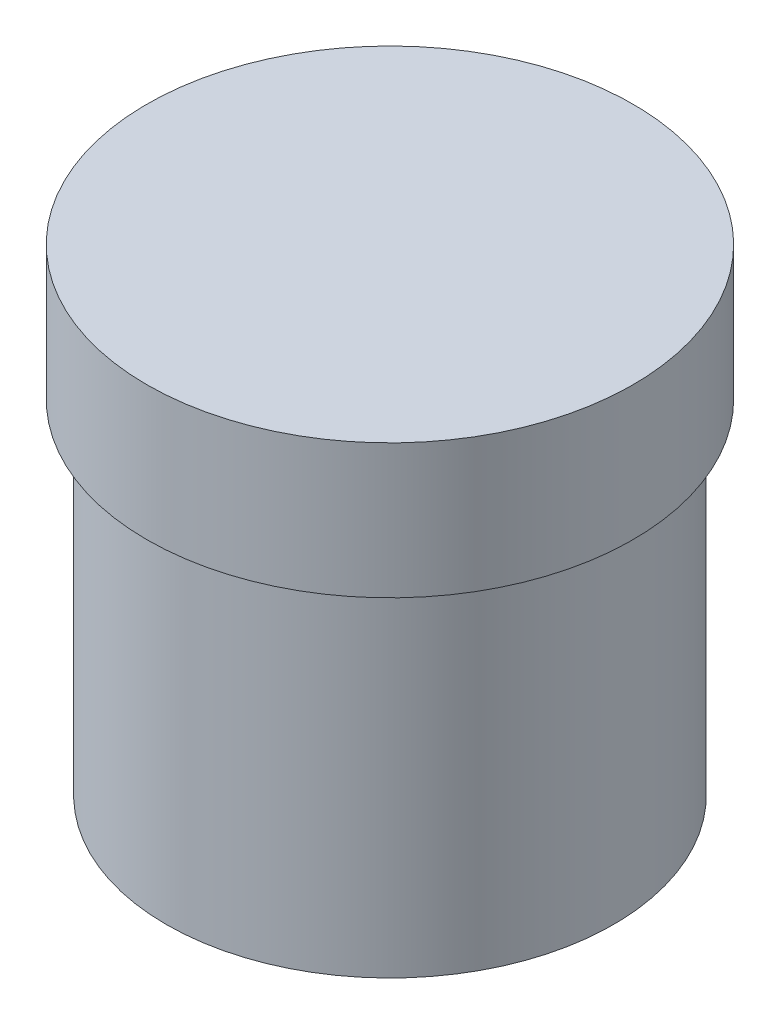
from build123d import *

# Parameters (mm, degrees)
SKETCH_1_R        = 16.3
EXTRUDE_212_DEPTH = 9
SKETCH_2_R        = 15
EXTRUDE_2_DEPTH   = 23


with BuildPart() as part:
    # 草图1 → Extrude 212 (new body)
    with BuildSketch(Plane(origin=(0, 0, 0), x_dir=(1, 0, 0), z_dir=(0, 1, 0))):
        with Locations(Location((0, 0, 0), (0, 0, 270))):
            Circle(SKETCH_1_R)
    extrude(amount=EXTRUDE_212_DEPTH)

    # 草图2 → 凸台-拉伸2 (add)
    with BuildSketch(Plane(origin=(0, 0, 0), x_dir=(1, 0, 0), z_dir=(0, 1, 0))):
        with Locations(Location((0, 0, 0), (0, 0, 270))):
            Circle(SKETCH_2_R)
    extrude(amount=-EXTRUDE_2_DEPTH)


solid = part.part
